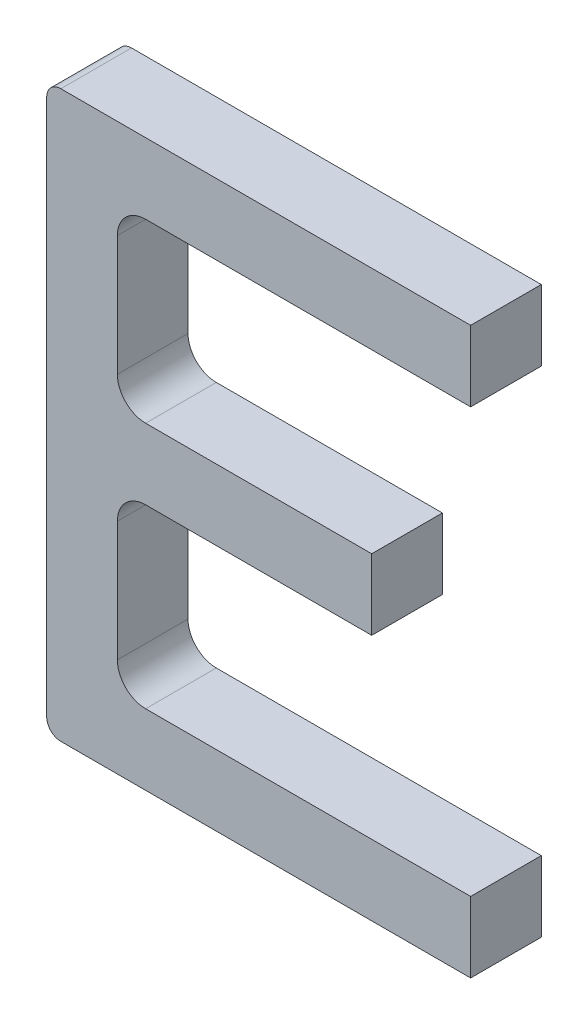
from build123d import *

# Parameters (mm, degrees)
SKETCH1_W           = 31.75
SKETCH1_H           = 6.35
SKETCH1_W_2         = 6.35
SKETCH1_H_2         = 50.8
SKETCH1_W_3         = 22.86
BOSS_EXTRUDE1_DEPTH = 6.35
FILLET1_R           = 2.54
FILLET2_R           = 1.27


with BuildPart() as part:
    # Sketch1 → Boss-Extrude1 (new body)
    with BuildSketch(Plane.XY):
        with Locations((22.225, 47.625)):
            Rectangle(SKETCH1_W, SKETCH1_H)
        with Locations((3.175, 25.4)):
            Rectangle(SKETCH1_W_2, SKETCH1_H_2)
        with Locations((17.78, 25.4)):
            Rectangle(SKETCH1_W_3, SKETCH1_H)
        with Locations((22.225, 3.175)):
            Rectangle(SKETCH1_W, SKETCH1_H)
    extrude(amount=BOSS_EXTRUDE1_DEPTH)

    # Fillet1
    fillet1_edges = [part.edges().sort_by_distance(p)[0] for p in [
        (6.35, 44.45, 3.175),
        (6.35, 28.575, 3.175),
        (6.35, 22.225, 3.175),
        (6.35, 6.35, 3.175),
    ]]
    fillet(fillet1_edges, radius=FILLET1_R)

    # Fillet2
    fillet2_edges = [part.edges().sort_by_distance(p)[0] for p in [
        (0, 0, 3.175),
        (0, 50.8, 3.175),
    ]]
    fillet(fillet2_edges, radius=FILLET2_R)


solid = part.part
